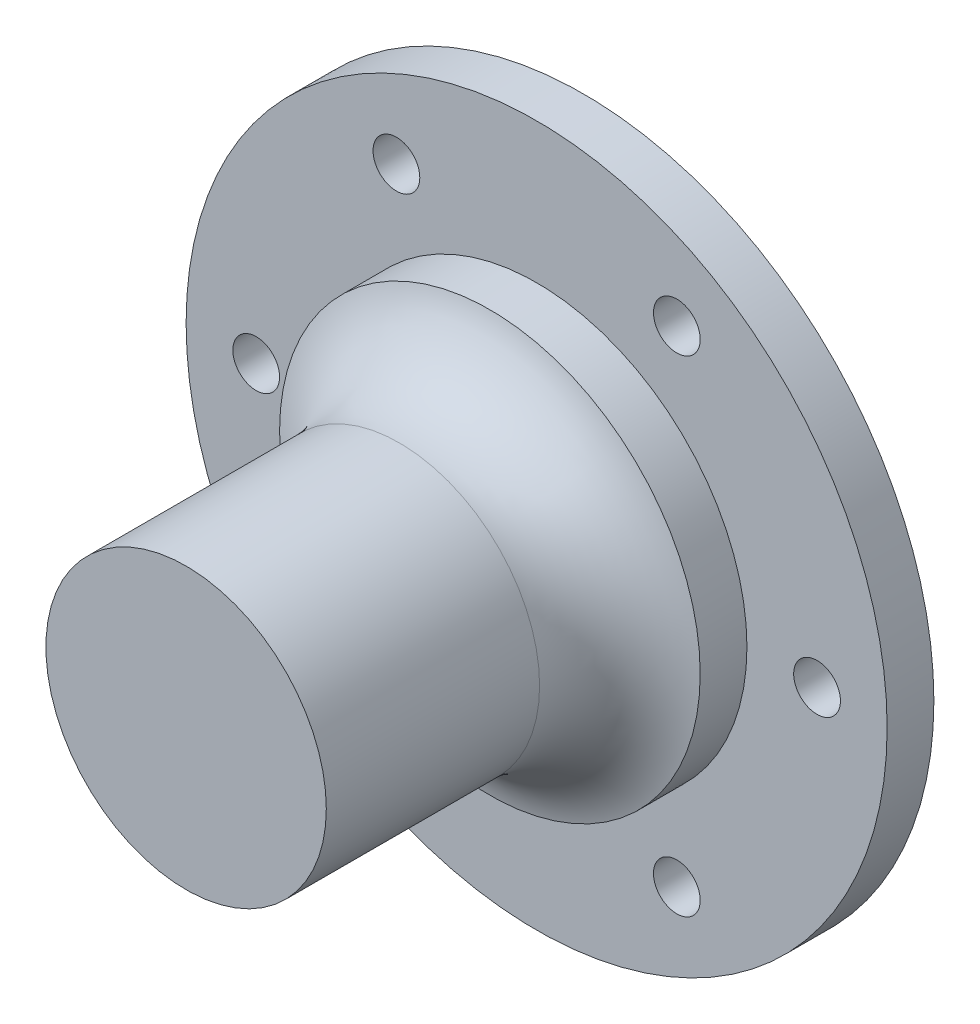
from build123d import *

# Parameters (mm, degrees)
SKETCH1_R           = 75
BOSS_EXTRUDE1_DEPTH = 10
SKETCH3_R           = 40
BOSS_EXTRUDE2_DEPTH = 10
SKETCH4_R           = 35
CUT_EXTRUDE1_DEPTH  = 20
SKETCH5_R           = 5
CUT_EXTRUDE2_DEPTH  = 20


with BuildPart() as part:
    # Sketch1 → Boss-Extrude1 (new body)
    with BuildSketch(Plane.XY):
        Circle(SKETCH1_R)
    extrude(amount=BOSS_EXTRUDE1_DEPTH)

    # Sketch2 → Revolve1 (revolve)
    with BuildSketch(Plane(origin=(0, 0, 0), x_dir=(0, 0, -1), z_dir=(1, 0, 0)), mode=Mode.PRIVATE) as revolve1_sk:
        with BuildLine():
            Line((-10, 45), (-20, 45))
            ThreePointArc((-20, 45), (-27.117468017, 34.188611699), (-39.364916731, 30))
            Line((-39.364916731, 30), (-85, 30))
            Line((-85, 30), (-85, 0))
            Line((-85, 0), (-10, 0))
            Line((-10, 0), (-10, 45))
        make_face()
    revolve(revolve1_sk.sketch.rotate(Axis((0, 0, 1000), (0, 0, -1)), 90), axis=Axis((0, 0, 1000), (0, 0, -1)))

    # Sketch3 → Boss-Extrude2 (add)
    with BuildSketch(Plane(origin=(0, 0, 0), x_dir=(-1, 0, 0), z_dir=(0, 0, -1))):
        Circle(SKETCH3_R)
    extrude(amount=BOSS_EXTRUDE2_DEPTH)

    # Sketch4 → Cut-Extrude1 (cut)
    with BuildSketch(Plane(origin=(0, 0, -10), x_dir=(-1, 0, 0), z_dir=(0, 0, -1))):
        Circle(SKETCH4_R)
    extrude(amount=-CUT_EXTRUDE1_DEPTH, mode=Mode.SUBTRACT)

    # Sketch5 → Cut-Extrude2 (cut)
    with BuildSketch(Plane.XY.offset(10)):
        with Locations((60, 0)):
            Circle(SKETCH5_R)
        with Locations((30, -51.961524227)):
            Circle(SKETCH5_R)
        with Locations((-30, -51.961524227)):
            Circle(SKETCH5_R)
        with Locations((-60, 0)):
            Circle(SKETCH5_R)
        with Locations((-30, 51.961524227)):
            Circle(SKETCH5_R)
        with Locations((30, 51.961524227)):
            Circle(SKETCH5_R)
    extrude(amount=-CUT_EXTRUDE2_DEPTH, mode=Mode.SUBTRACT)


solid = part.part
